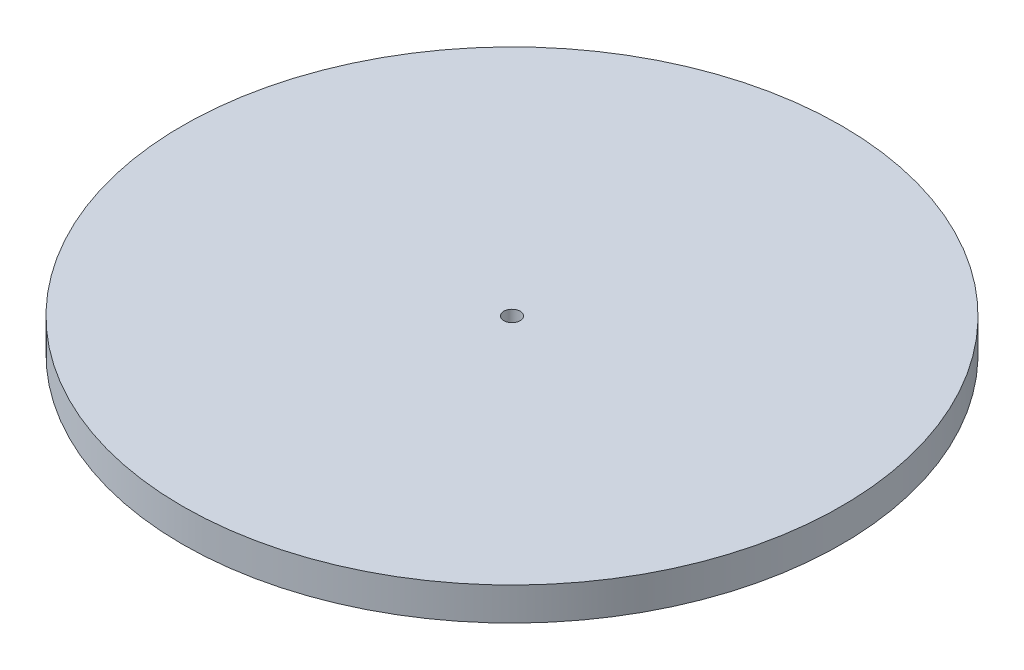
from build123d import *

# Parameters (mm, degrees)
SKETCH1_R           = 200
SKETCH1_R_2         = 5
BOSS_EXTRUDE1_DEPTH = 20


with BuildPart() as part:
    # Sketch1 → Boss-Extrude1 (new body)
    with BuildSketch(Plane(origin=(0, 0, 0), x_dir=(1, 0, 0), z_dir=(0, 1, 0))):
        with Locations(Location((0, 0, 0), (0, 0, 270))):
            Circle(SKETCH1_R)
        with Locations(Location((0, 0, 0), (0, 0, 270))):
            Circle(SKETCH1_R_2, mode=Mode.SUBTRACT)
    extrude(amount=BOSS_EXTRUDE1_DEPTH)


solid = part.part
